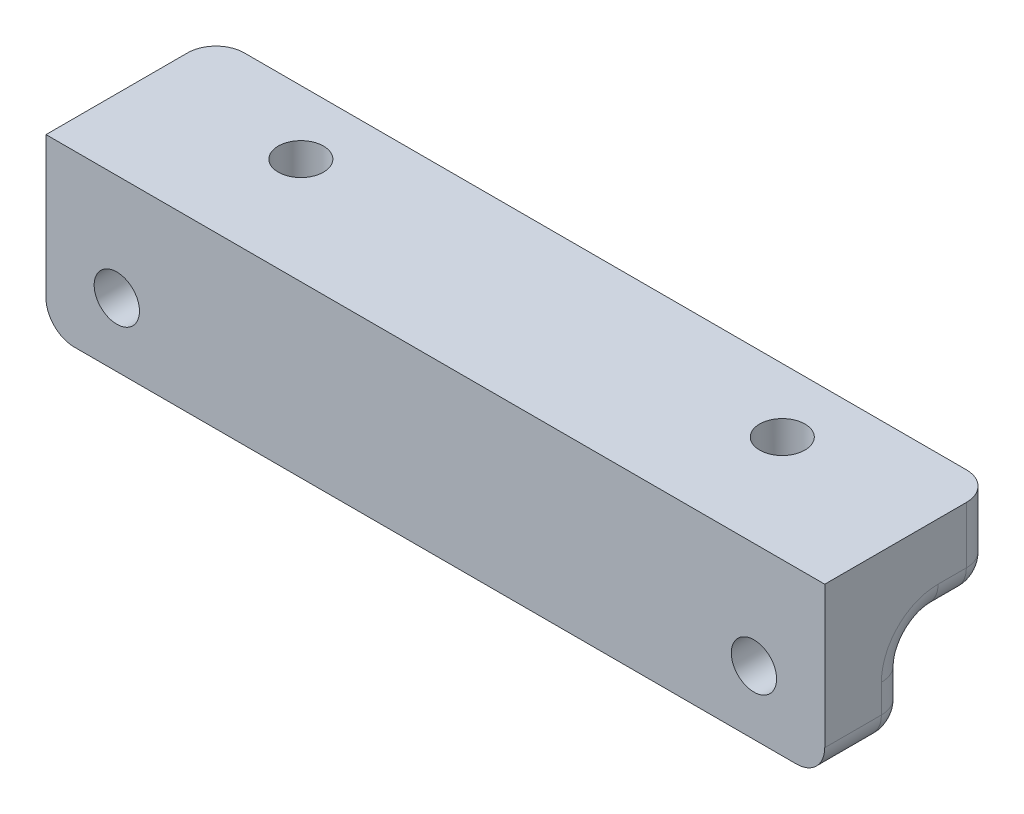
from build123d import *

# Parameters (mm, degrees)
EXTRU_MINCE1_DEPTH      = 27.5
CONG_2_R                = 2
ESQUISSE2_R             = 1.6
ENL_V_MAT_EXTRU_1_DEPTH = 33.314857264
ESQUISSE3_R             = 1.6
ENL_V_MAT_EXTRU_2_DEPTH = 33.314857386
ENL_V_START             = -3
ENL_V_MAT_EXTRU_3_DEPTH = 30.314857423
ENL_V_MAT_EXTRU_4_DEPTH = 30.314857386
CONG_1_R                = 2


with BuildPart() as part:
    # Esquisse1 → Extru.-Mince1 (new, symmetric)
    with BuildSketch(Plane(origin=(0, 0, 0), x_dir=(0, 0, -1), z_dir=(1, 0, 0))):
        Polygon((12, 0), (0, 0), (0, -12), (6, -12), (6, -6), (12, -6), align=None)
    extrude(amount=EXTRU_MINCE1_DEPTH, both=True)

    # Congé2
    cong_2_edges = [part.edges().sort_by_distance(p)[0] for p in [
        (0, -12, -6),
        (0, -6, -12),
        (0, -6, -6),
    ]]
    fillet(cong_2_edges, radius=CONG_2_R)

    # Esquisse2 → Enlèv. mat.-Extru.1 (cut, through all)
    with BuildSketch(Plane(origin=(0, 0, 0), x_dir=(1, 0, 0), z_dir=(0, 1, 0))):
        with Locations((-17, 7.5)):
            Circle(ESQUISSE2_R)
        with Locations((17, 7.5)):
            Circle(ESQUISSE2_R)
    extrude(amount=-ENL_V_MAT_EXTRU_1_DEPTH, mode=Mode.SUBTRACT)

    # Esquisse3 → Enlèv. mat.-Extru.2 (cut, through all)
    with BuildSketch(Plane.XY):
        with Locations((22.5, -7.5)):
            Circle(ESQUISSE3_R)
        with Locations((-22.5, -7.5)):
            Circle(ESQUISSE3_R)
    extrude(amount=-ENL_V_MAT_EXTRU_2_DEPTH, mode=Mode.SUBTRACT)

    # Esquisse4 → Enlèv. mat.-Extru.3 (cut, through all)
    with BuildSketch(Plane(origin=(0, 0, 0), x_dir=(1, 0, 0), z_dir=(0, 1, 0)).offset(ENL_V_START)):
        Polygon((-14.25, 9.08771324), (-17, 10.675426481), (-19.75, 9.08771324), (-19.75, 5.91228676), (-17, 4.324573519), (-14.25, 5.91228676), align=None)
        Polygon((19.75, 9.08771324), (17, 10.675426481), (14.25, 9.08771324), (14.25, 5.91228676), (17, 4.324573519), (19.75, 5.91228676), align=None)
    extrude(amount=-ENL_V_MAT_EXTRU_3_DEPTH, mode=Mode.SUBTRACT)

    # Esquisse5 → Enlèv. mat.-Extru.4 (cut, through all)
    with BuildSketch(Plane.XY.offset(ENL_V_START)):
        Polygon((25.25, -5.91228676), (22.5, -4.324573519), (19.75, -5.91228676), (19.75, -9.08771324), (22.5, -10.675426481), (25.25, -9.08771324), align=None)
        Polygon((-19.75, -9.08771324), (-19.75, -5.91228676), (-22.5, -4.324573519), (-25.25, -5.91228676), (-25.25, -9.08771324), (-22.5, -10.675426481), align=None)
    extrude(amount=-ENL_V_MAT_EXTRU_4_DEPTH, mode=Mode.SUBTRACT)

    # Congé1
    cong_1_edges = [part.edges().sort_by_distance(p)[0] for p in [
        (27.5, -2, -12),
        (-27.5, -2, -12),
        (27.5, -12, -2),
        (27.5, -11.414213562, -5.414213562),
        (27.5, -9, -6),
        (27.5, -6.585786438, -6.585786438),
        (27.5, -6, -9),
        (27.5, -5.414213562, -11.414213562),
        (-27.5, -12, -2),
        (-27.5, -11.414213562, -5.414213562),
        (-27.5, -9, -6),
        (-27.5, -6.585786438, -6.585786438),
        (-27.5, -6, -9),
        (-27.5, -5.414213562, -11.414213562),
    ]]
    fillet(cong_1_edges, radius=CONG_1_R)


solid = part.part
